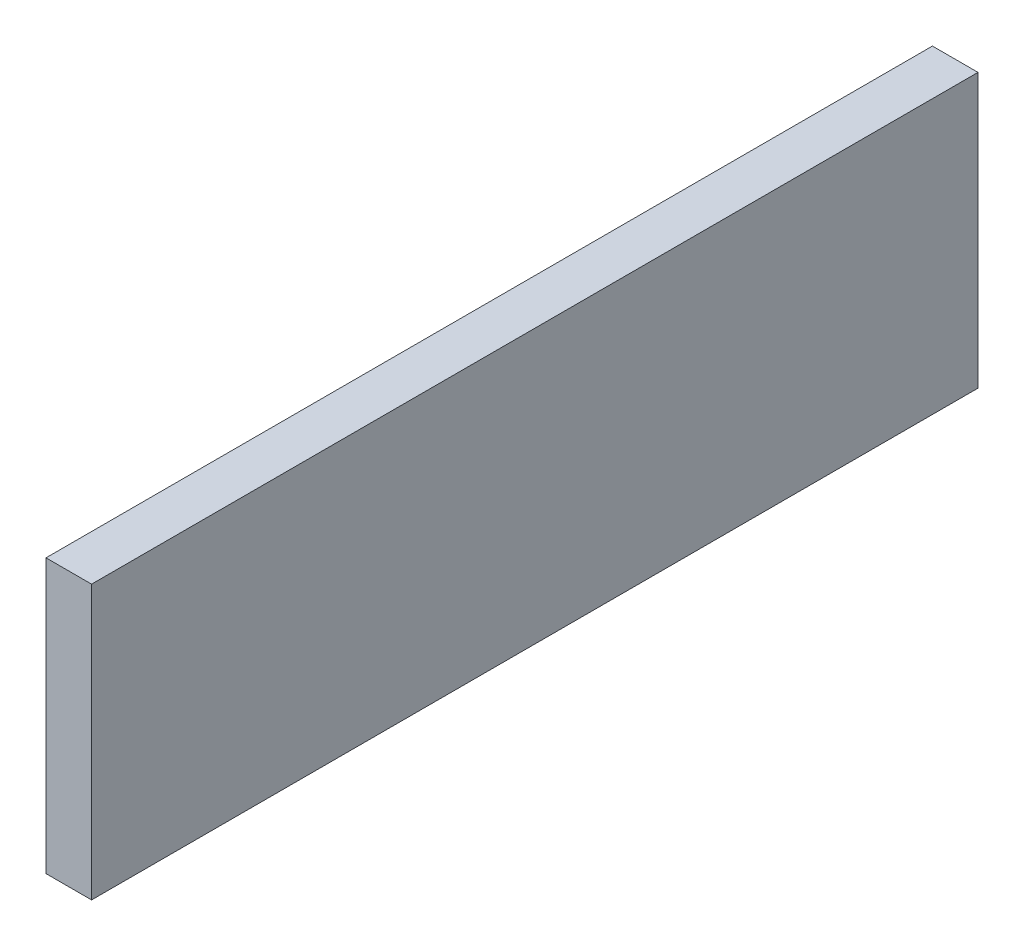
from build123d import *

# Parameters (mm, degrees)
IZIM1_W                     = 275
IZIM1_H                     = 84.85
Y_KSEKLIK_EKSTR_ZYON1_DEPTH = 14.14


with BuildPart() as part:
    # Çizim1 → Yükseklik-Ekstrüzyon1 (new body)
    with BuildSketch(Plane(origin=(0, 0, 0), x_dir=(0, 0, -1), z_dir=(1, 0, 0))):
        with Locations((137.5, 42.425)):
            Rectangle(IZIM1_W, IZIM1_H)
    extrude(amount=Y_KSEKLIK_EKSTR_ZYON1_DEPTH)


solid = part.part
